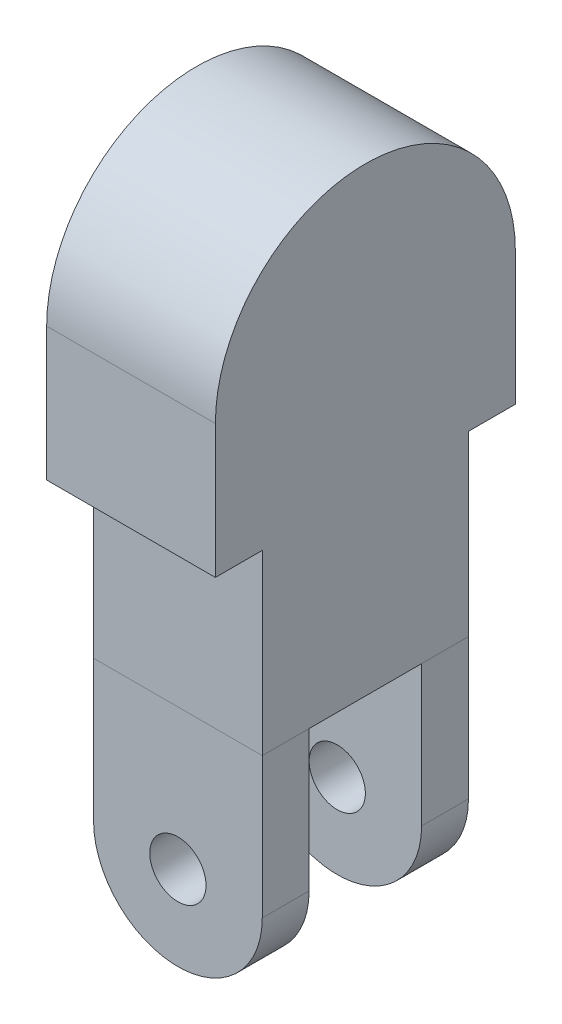
from build123d import *

# Parameters (mm, degrees)
SKETCH1_R           = 4.5
SKETCH1_R_2         = 1.5
BOSS_EXTRUDE1_DEPTH = 2.5
SKETCH4_R           = 4.5
SKETCH4_R_2         = 1.5
BOSS_EXTRUDE2_DEPTH = 2.5
SKETCH5_W           = 9
SKETCH5_H           = 11
BOSS_EXTRUDE3_DEPTH = 9.48
SKETCH6_W           = 9
SKETCH6_H           = 2.5
SKETCH6_H_2         = 11
BOSS_EXTRUDE4_DEPTH = 7.11
SKETCH9_R           = 8
BOSS_EXTRUDE5_DEPTH = 9


with BuildPart() as part:
    # Sketch1 → Boss-Extrude1 (new body)
    # profile 1 of 2: a face of its own
    with BuildSketch(Plane.XY):
        Circle(SKETCH1_R)
        Circle(SKETCH1_R_2, mode=Mode.SUBTRACT)
    # profile 2 of 2: a face of its own
    with BuildSketch(Plane.XY):
        with BuildLine():
            Line((-4.5, 7.5), (-4.5, 0))
            ThreePointArc((-4.5, 0), (0, 4.5), (4.5, 0))
            Line((4.5, 0), (4.5, 7.5))
            Line((4.5, 7.5), (-4.5, 7.5))
        make_face()
    extrude(amount=-BOSS_EXTRUDE1_DEPTH)


with BuildPart() as body_2:
    # Sketch4 → Boss-Extrude2 (new body)
    # profile 1 of 2: a face of its own
    with BuildSketch(Plane(origin=(0, 0, -11), x_dir=(-1, 0, 0), z_dir=(0, 0, -1))):
        Circle(SKETCH4_R)
        Circle(SKETCH4_R_2, mode=Mode.SUBTRACT)
    # profile 2 of 2: a face of its own
    with BuildSketch(Plane(origin=(0, 0, -11), x_dir=(-1, 0, 0), z_dir=(0, 0, -1))):
        with BuildLine():
            Line((-4.5, 7.5), (-4.5, 0))
            ThreePointArc((-4.5, 0), (0, 4.5), (4.5, 0))
            Line((4.5, 0), (4.5, 7.5))
            Line((4.5, 7.5), (-4.5, 7.5))
        make_face()
    extrude(amount=-BOSS_EXTRUDE2_DEPTH)


with BuildPart() as body_3:
    # Sketch5 → Boss-Extrude3 (new body)
    with BuildSketch(Plane(origin=(0, 7.5, 0), x_dir=(1, 0, 0), z_dir=(0, 1, 0))):
        with Locations((0, 5.5)):
            Rectangle(SKETCH5_W, SKETCH5_H)
    extrude(amount=BOSS_EXTRUDE3_DEPTH)



with BuildPart() as body_4:
    # Sketch6 → Boss-Extrude4 (new body)
    with BuildSketch(Plane(origin=(0, 16.98, 0), x_dir=(1, 0, 0), z_dir=(0, 1, 0))):
        with Locations((0, 12.25)):
            Rectangle(SKETCH6_W, SKETCH6_H)
        with Locations((0, 5.5)):
            Rectangle(SKETCH6_W, SKETCH6_H_2)
        with Locations((0, -1.25)):
            Rectangle(SKETCH6_W, SKETCH6_H)
    extrude(amount=BOSS_EXTRUDE4_DEPTH)


with BuildPart() as body_3_1:
    add(body_3.part)

    add(body_4.part)  # Boss-Extrude5 merges body 4
    # Sketch9 → Boss-Extrude5 (add)
    with BuildSketch(Plane(origin=(4.5, 0, 0), x_dir=(0, 0, -1), z_dir=(1, 0, 0))):
        with Locations((5.5, 24.09)):
            Circle(SKETCH9_R)
    extrude(amount=-BOSS_EXTRUDE5_DEPTH)


solid = Compound([part.part, body_2.part, body_3_1.part])
